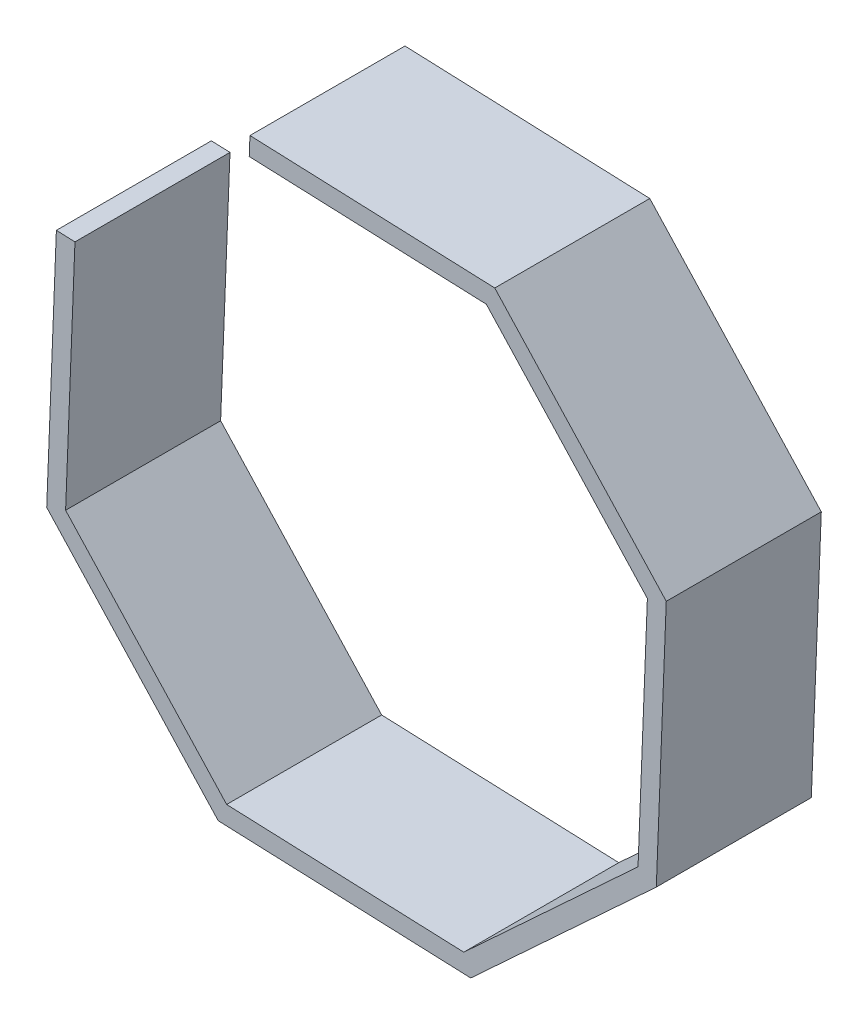
from build123d import *

# Parameters (mm, degrees)
EXTRUDE_THIN3_DEPTH = 25


with BuildPart() as part:
    # Sketch1 → Extrude-Thin3 (new body)
    with BuildSketch(Plane.XY):
        Polygon((-45.403860527, 20.940139667), (-46.912292428, -17.298462913), (-20.940139667, -45.403860527), (17.298462913, -46.912292428), (45.403860527, -20.940139667), (46.912292428, 17.298462913), (20.940139667, 45.403860527), (-17.298462913, 46.912292428), (-17.180211238, 49.909960945), (22.300066297, 48.352547597), (49.958942393, 18.421886194), (48.352547597, -22.300066297), (18.421886194, -49.958942393), (-22.300066297, -48.352547597), (-49.958942393, -18.421886194), (-48.401529044, 21.058391342), align=None)
    extrude(amount=EXTRUDE_THIN3_DEPTH)


solid = part.part
